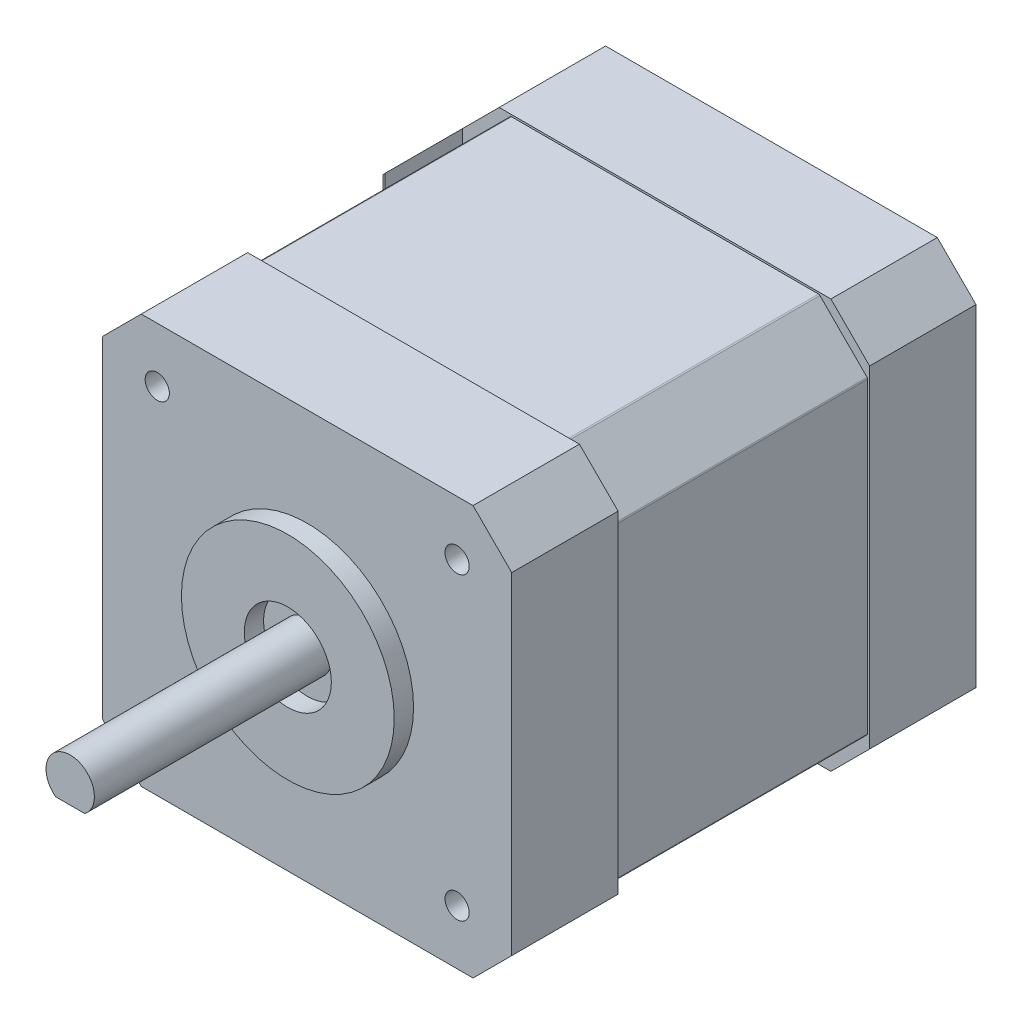
from build123d import *

# Parameters (mm, degrees)
BOSS_EXTRU_1_DEPTH                  = 26
ESQUISSE2_W                         = 42.1
ESQUISSE2_H                         = 42.3
BOSS_EXTRU_2_DEPTH                  = 11
ESQUISSE3_W                         = 11
ESQUISSE3_H                         = 42.3
BOSS_EXTRU_3_DEPTH                  = 0.2
ESQUISSE4_W                         = 42.3
ESQUISSE4_H                         = 42.3
BOSS_EXTRU_4_DEPTH                  = 11
ESQUISSE5_R                         = 11
BOSS_EXTRU_5_DEPTH                  = 2
DIAM_TRE_DU_PER_AGE_9_0_9_1_D       = 9
DIAM_TRE_DU_PER_AGE_9_0_9_1_DEPTH   = 2
ESQUISSE8_R                         = 2.5
BOSS_EXTRU_6_DEPTH                  = 24.5
ENL_V_START                         = -15
ENL_V_MAT_EXTRU_1_DEPTH             = 15
DIAM_TRE_DU_PER_AGE_2_5_2_5_1_D     = 2.5
DIAM_TRE_DU_PER_AGE_2_5_2_5_1_DEPTH = 7.5
DIAM_TRE_DU_PER_AGE_2_5_2_5_1_TIP   = 0.751075774
DIAM_TRE_DU_PER_AGE_4_0_4_1_D       = 4
DIAM_TRE_DU_PER_AGE_4_0_4_1_DEPTH   = 2
DIAM_TRE_DU_PER_AGE_10_0_10_1_D     = 10
DIAM_TRE_DU_PER_AGE_10_0_10_1_DEPTH = 2
CHANFREIN1_SIZE                     = 4
CONG_1_R                            = 0.2


with BuildPart() as part:
    # Esquisse1 → Boss.-Extru.1 (new body)
    with BuildSketch(Plane.XY.offset(-11)):
        Polygon((20.95, 15.95), (15.95, 20.95), (-15.95, 20.95), (-20.95, 15.95), (-20.95, -15.95), (-15.95, -20.95), (15.95, -20.95), (20.95, -15.95), align=None)
    extrude(amount=-BOSS_EXTRU_1_DEPTH)

    # Esquisse2 → Boss.-Extru.2 (add)
    with BuildSketch(Plane(origin=(0, 0, -37), x_dir=(-1, 0, 0), z_dir=(0, 0, -1))):
        with Locations((-0.1, 0)):
            Rectangle(ESQUISSE2_W, ESQUISSE2_H)
    extrude(amount=BOSS_EXTRU_2_DEPTH)

    # Esquisse3 → Boss.-Extru.3 (add)
    with BuildSketch(Plane.ZY.offset(20.95)):
        with Locations((-34.5, 0)):
            Rectangle(ESQUISSE3_W, ESQUISSE3_H)
    extrude(amount=BOSS_EXTRU_3_DEPTH)

    # Esquisse4 → Boss.-Extru.4 (add)
    with BuildSketch(Plane(origin=(0, 0, -11), x_dir=(-1, 0, 0), z_dir=(0, 0, -1))):
        Rectangle(ESQUISSE4_W, ESQUISSE4_H)
    extrude(amount=-BOSS_EXTRU_4_DEPTH)

    # Esquisse5 → Boss.-Extru.5 (add)
    with BuildSketch(Plane.XY):
        with Locations(Location((0, 0, 0), (0, 0, 180))):
            Circle(ESQUISSE5_R)
    extrude(amount=BOSS_EXTRU_5_DEPTH)

    # Diamètre du perçage Ø9.0 (9)1
    with Locations(Plane.XY.offset(2)):
        with Locations((0, 0)):
            Hole(DIAM_TRE_DU_PER_AGE_9_0_9_1_D / 2, depth=DIAM_TRE_DU_PER_AGE_9_0_9_1_DEPTH)

    # Esquisse8 → Boss.-Extru.6 (add)
    with BuildSketch(Plane.XY):
        with Locations(Location((0, 0, 0), (0, 0, 180))):
            Circle(ESQUISSE8_R)
    extrude(amount=BOSS_EXTRU_6_DEPTH)

    # Esquisse9 → Enlèv. mat.-Extru.1 (cut)
    with BuildSketch(Plane.XY.offset(24.5).offset(ENL_V_START)):
        with BuildLine():
            Line((1.5, -2), (-1.5, -2))
            ThreePointArc((-1.5, -2), (0, -2.5), (1.5, -2))
        make_face()
    extrude(amount=ENL_V_MAT_EXTRU_1_DEPTH, mode=Mode.SUBTRACT)

    # Diamètre du perçage Ø2.5 (2.5)1
    with Locations(Plane.XY):
        with Locations((-15.5, 15.5), (-15.5, -15.5), (15.5, -15.5), (15.5, 15.5)):
            Hole(DIAM_TRE_DU_PER_AGE_2_5_2_5_1_D / 2, depth=DIAM_TRE_DU_PER_AGE_2_5_2_5_1_DEPTH)
            with Locations((0, 0, -(DIAM_TRE_DU_PER_AGE_2_5_2_5_1_DEPTH + DIAM_TRE_DU_PER_AGE_2_5_2_5_1_TIP / 2))):  # 118° drill point
                Cone(0, DIAM_TRE_DU_PER_AGE_2_5_2_5_1_D / 2, DIAM_TRE_DU_PER_AGE_2_5_2_5_1_TIP, mode=Mode.SUBTRACT)

    # Diamètre du perçage Ø4.0 (4)1
    with Locations(Plane(origin=(0, 0, -48), x_dir=(-1, 0, 0), z_dir=(0, 0, -1))):
        with Locations((-15.5, -15.5), (-15.5, 15.5), (15.5, 15.5), (15.5, -15.5)):
            Hole(DIAM_TRE_DU_PER_AGE_4_0_4_1_D / 2, depth=DIAM_TRE_DU_PER_AGE_4_0_4_1_DEPTH)

    # Diamètre du perçage Ø10.0 (10)1
    with Locations(Plane(origin=(0, 0, -48), x_dir=(-1, 0, 0), z_dir=(0, 0, -1))):
        with Locations((0, 0)):
            Hole(DIAM_TRE_DU_PER_AGE_10_0_10_1_D / 2, depth=DIAM_TRE_DU_PER_AGE_10_0_10_1_DEPTH)

    # Chanfrein1
    chanfrein1_edges = [part.edges().sort_by_distance(p)[0] for p in [
        (21.15, 21.15, -42.5),
        (-21.15, -21.15, -34.5),
        (21.15, -21.15, -42.5),
        (-21.15, 21.15, -5.5),
        (-21.15, -21.15, -5.5),
        (21.15, -21.15, -5.5),
        (-21.15, 21.15, -34.5),
        (21.15, 21.15, -5.5),
    ]]
    chamfer(chanfrein1_edges, length=CHANFREIN1_SIZE)

    # Congé1
    cong_1_edges = [part.edges().sort_by_distance(p)[0] for p in [
        (20.95, -15.95, -24),
        (15.95, -20.95, -24),
        (-15.95, -20.95, -24),
        (-15.95, 20.95, -24),
        (15.95, 20.95, -24),
        (20.95, 15.95, -24),
        (-20.95, 15.95, -20),
        (-20.95, -15.95, -20),
    ]]
    fillet(cong_1_edges, radius=CONG_1_R)


solid = part.part
